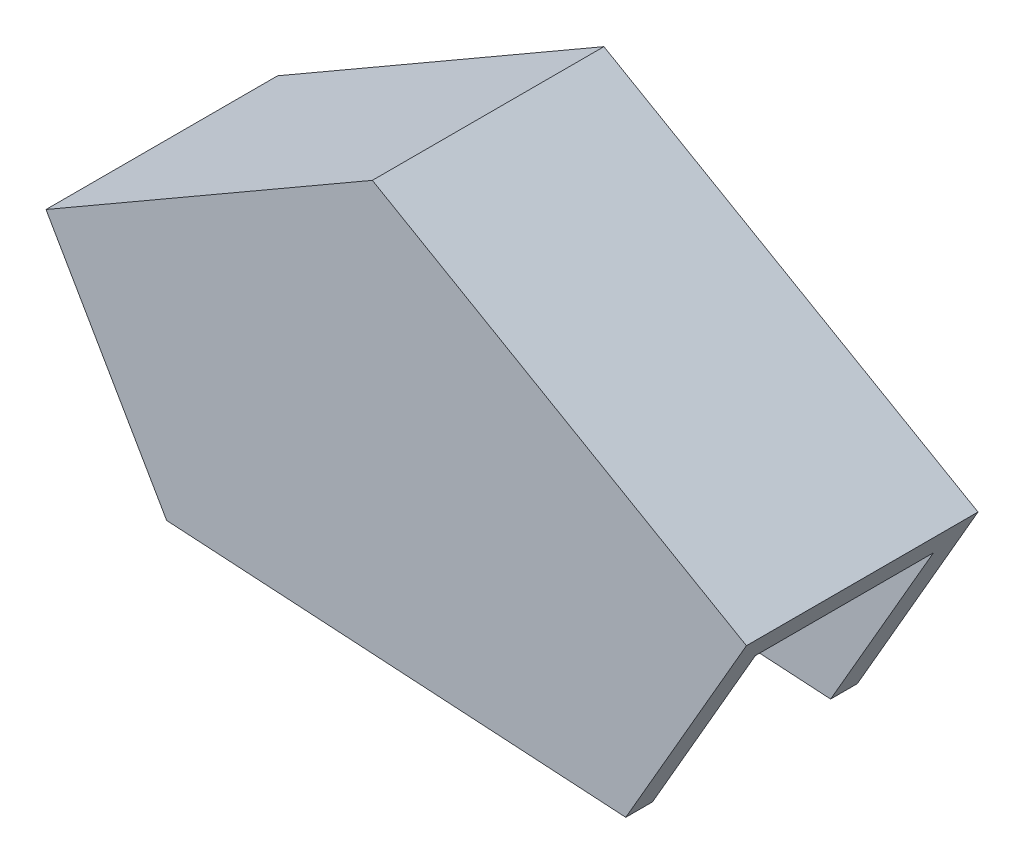
from build123d import *

# Parameters (mm, degrees)
BOSS_EXTRUDE1_DEPTH = 10
BOSS_EXTRUDE2_DEPTH = 1.5


with BuildPart() as part:
    # Sketch1 → Boss-Extrude1 (new body)
    with BuildSketch(Plane.XY):
        Polygon((0, 0), (20, -11.547005384), (21, -9.814954576), (0, 2.309401077), (-18.320508076, -8.267949192), (-17.320508076, -10), align=None)
    extrude(amount=BOSS_EXTRUDE1_DEPTH)

    # Sketch2 → Boss-Extrude2 (add)
    with BuildSketch(Plane.XY.offset(10)):
        Polygon((-18.320508076, -8.267949192), (0, 2.309401077), (21, -9.814954576), (20, -11.547005384), (14.226497308, -21.547005384), (-11.547005384, -20), (-17.320508076, -10), align=None)
    boss_extrude2 = extrude(amount=BOSS_EXTRUDE2_DEPTH)

    # Mirror1: Boss-Extrude2 across plane
    add(boss_extrude2.mirror(Plane(origin=(0, 0, 5), x_dir=(1, 0, 0), z_dir=(0, 0, -1))))


solid = part.part
